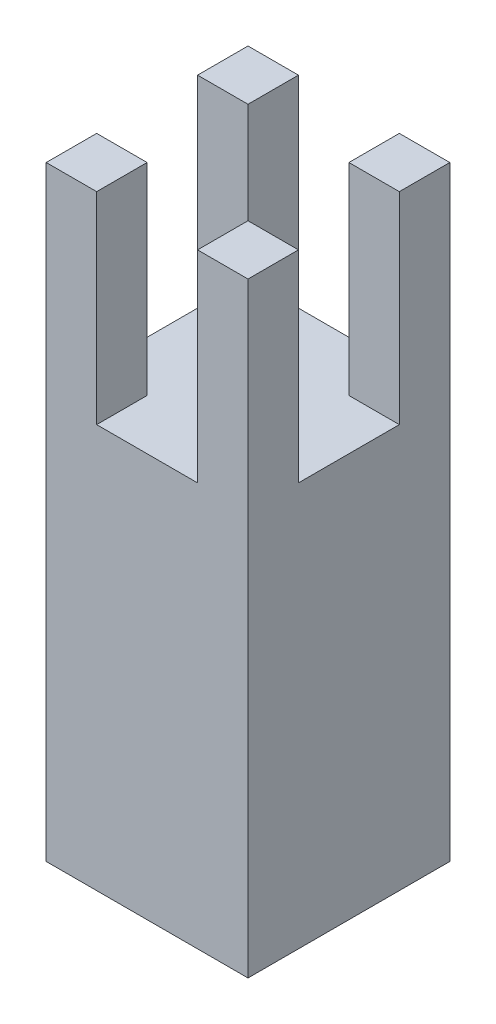
from build123d import *

# Parameters (mm, degrees)
SKETCH1_W           = 101.6
SKETCH1_H           = 101.6
BOSS_EXTRUDE1_DEPTH = 304.8
SKETCH2_W           = 50.8
SKETCH2_H           = 101.6
SKETCH2_W_2         = 101.6
SKETCH2_H_2         = 50.8
CUT_EXTRUDE3_DEPTH  = 101.6


with BuildPart() as part:
    # Sketch1 → Boss-Extrude1 (new body)
    with BuildSketch(Plane(origin=(0, 0, 0), x_dir=(1, 0, 0), z_dir=(0, 1, 0))):
        Rectangle(SKETCH1_W, SKETCH1_H)
    extrude(amount=BOSS_EXTRUDE1_DEPTH)

    # Sketch2 → Cut-Extrude3 (cut)
    with BuildSketch(Plane(origin=(0, 304.8, 0), x_dir=(1, 0, 0), z_dir=(0, 1, 0))):
        Rectangle(SKETCH2_W, SKETCH2_H)
        Rectangle(SKETCH2_W_2, SKETCH2_H_2)
    extrude(amount=-CUT_EXTRUDE3_DEPTH, mode=Mode.SUBTRACT)


solid = part.part
